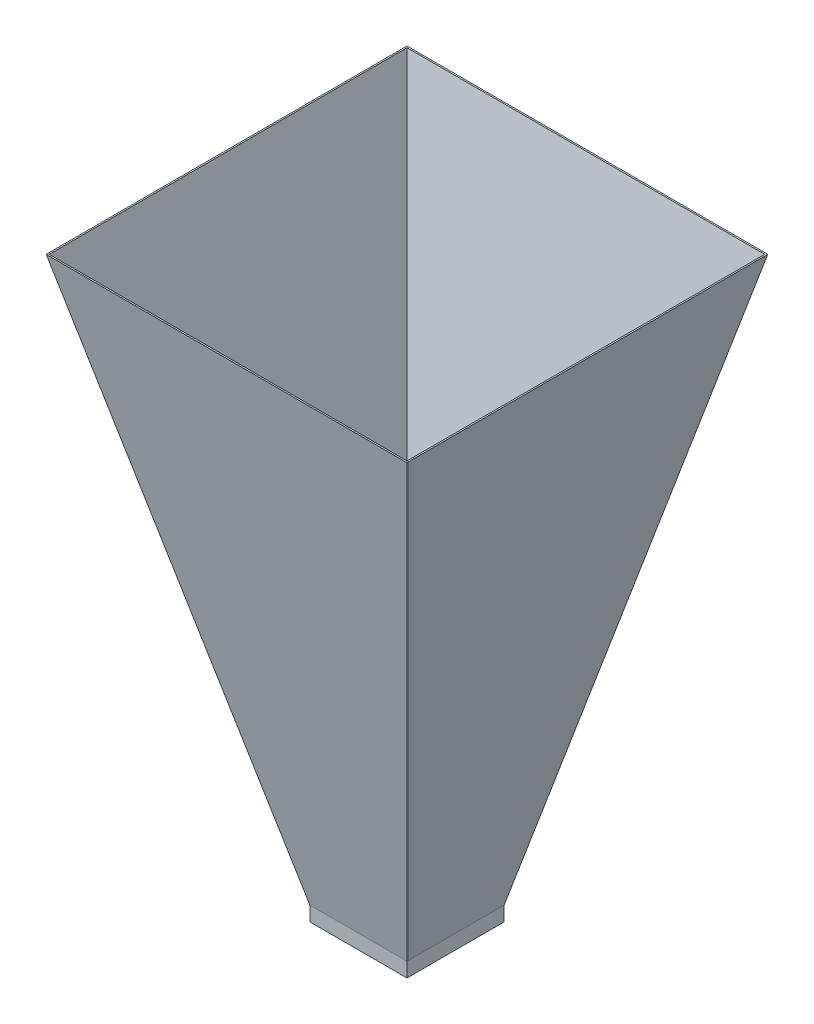
from build123d import *

# Parameters (mm, degrees)
SKETCH4_W           = 67
SKETCH4_H           = 67
BOSS_EXTRUDE1_DEPTH = 10
SHELL1_T            = -1
SKETCH5_W           = 633.424924629
SKETCH5_H           = 1048.938211475


with BuildPart() as part:
    # Sketch1 → Loft1 section 0
    with BuildSketch(Plane(origin=(0, 20, 0), x_dir=(1, 0, 0), z_dir=(0, 1, 0))):
        with BuildLine():
            Line((-33.5, -33.5), (33.5, -33.5))
            Line((33.5, -33.5), (33.5, 33.5))
            Line((33.5, 33.5), (-33.5, 33.5))
            Line((-33.5, 33.5), (-33.5, -33.5))
        make_face()
    # Sketch3 → Loft1 section 1
    with BuildSketch(Plane(origin=(0, 409, 0), x_dir=(1, 0, 0), z_dir=(0, 1, 0))):
        with BuildLine():
            Line((-124.5, 124.5), (-124.5, -124.5))
            Line((-124.5, -124.5), (124.5, -124.5))
            Line((124.5, -124.5), (124.5, 124.5))
            Line((124.5, 124.5), (-124.5, 124.5))
        make_face()
    loft()

    # Sketch4 → Boss-Extrude1 (add)
    with BuildSketch(Plane.XZ.offset(-20)):
        Rectangle(SKETCH4_W, SKETCH4_H)
    extrude(amount=BOSS_EXTRUDE1_DEPTH)

    # Shell1
    shell1_openings = [part.faces().sort_by_distance(p)[0] for p in [
        (0, 409, 0),
        (0, 10, 0),
    ]]
    offset(amount=SHELL1_T, openings=shell1_openings, kind=Kind.INTERSECTION)


with BuildPart() as body_2:
    # Split2: the piece on the far side of the plane
    add(part.part)
    split(bisect_by=Plane.ZX.offset(20), keep=Keep.BOTTOM)


with BuildPart() as part_1:
    add(part.part)

    # Split2
    split(bisect_by=Plane.ZX.offset(20), keep=Keep.TOP)


with BuildPart() as body_3:
    # Split1: the piece behind the surface
    add(part_1.part)
    # Sketch5 → Surface-Plane1: a flat surface bounded by the sketch
    with BuildSketch(Plane(origin=(0, -6.164658342, 26.352220824), x_dir=(-1, 0, 0), z_dir=(0, 0.2277834821060713, -0.9737118081237555)), mode=Mode.PRIVATE) as surface_plane1_1_region:
        with Locations((37.459244568, 105.176722524)):
            Rectangle(SKETCH5_W, SKETCH5_H)
    surface_plane1_1 = surface_plane1_1_region.sketch.faces()[0]
    split(bisect_by=surface_plane1_1, keep=Keep.BOTTOM)


with BuildPart() as part_2:
    add(part_1.part)

    # Split1: split by a surface, the side it looks to stays
    # Sketch5 → Surface-Plane1: a flat surface bounded by the sketch
    with BuildSketch(Plane(origin=(0, -6.164658342, 26.352220824), x_dir=(-1, 0, 0), z_dir=(0, 0.2277834821060713, -0.9737118081237555)), mode=Mode.PRIVATE) as surface_plane1_2_region:
        with Locations((37.459244568, 105.176722524)):
            Rectangle(SKETCH5_W, SKETCH5_H)
    surface_plane1_2 = surface_plane1_2_region.sketch.faces()[0]
    split(bisect_by=surface_plane1_2, keep=Keep.TOP)


solid = Compound([body_2.part, body_3.part, part_2.part])
